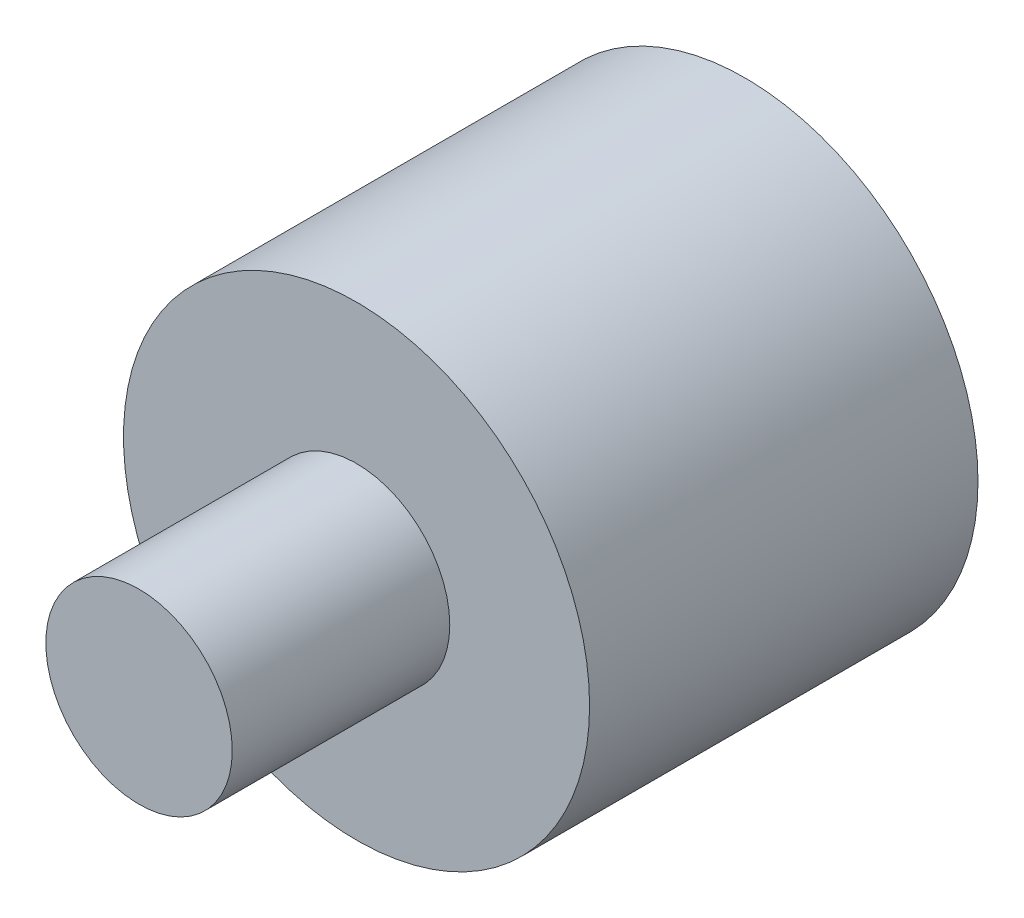
from build123d import *

# Parameters (mm, degrees)
SKETCH1_R           = 7.5
BOSS_EXTRUDE1_DEPTH = 12.5
SKETCH2_R           = 3
BOSS_EXTRUDE2_DEPTH = 7


with BuildPart() as part:
    # Sketch1 → Boss-Extrude1 (new body)
    with BuildSketch(Plane.XY):
        Circle(SKETCH1_R)
    extrude(amount=BOSS_EXTRUDE1_DEPTH)

    # Sketch2 → Boss-Extrude2 (add)
    with BuildSketch(Plane.XY.offset(12.5)):
        Circle(SKETCH2_R)
    extrude(amount=BOSS_EXTRUDE2_DEPTH)


solid = part.part
